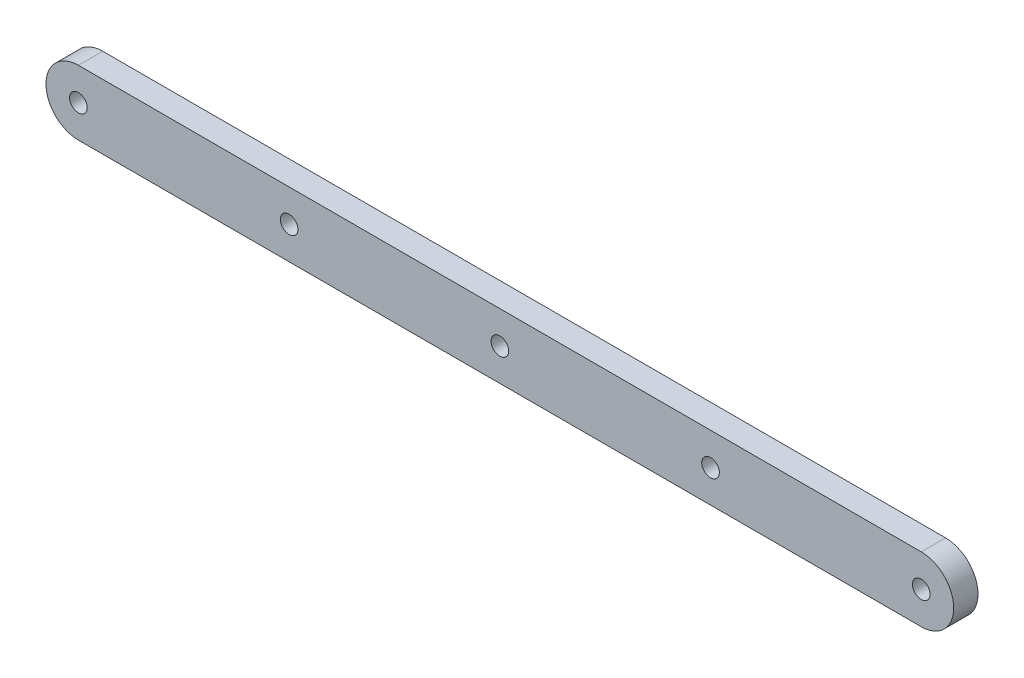
from build123d import *

# Parameters (mm, degrees)
BOSS_EXTRUDE1_DEPTH       = 4.7625
F_8_32_TAPPED_HOLE1_D     = 3.4544
F_8_32_TAPPED_HOLE1_DEPTH = 12.192
F_8_32_TAPPED_HOLE1_TIP   = 1.037806461


with BuildPart() as part:
    # Sketch1 → Boss-Extrude1 (new body)
    with BuildSketch(Plane.XY):
        with BuildLine():
            Line((-82.55, 0), (82.55, 0))
            ThreePointArc((82.55, 0), (88.9, 6.35), (82.55, 12.7))
            Line((82.55, 12.7), (-82.55, 12.7))
            ThreePointArc((-82.55, 12.7), (-88.9, 6.35), (-82.55, 0))
        make_face()
    extrude(amount=BOSS_EXTRUDE1_DEPTH)

    # #8-32 Tapped Hole1
    with Locations(Plane.XY.offset(4.7625)):
        with Locations((-82.55, 6.35), (82.55, 6.35), (0, 6.35), (41.27152138, 6.35), (-41.276070924, 6.35)):
            Hole(F_8_32_TAPPED_HOLE1_D / 2, depth=F_8_32_TAPPED_HOLE1_DEPTH)
            with Locations((0, 0, -(F_8_32_TAPPED_HOLE1_DEPTH + F_8_32_TAPPED_HOLE1_TIP / 2))):  # 118° drill point
                Cone(0, F_8_32_TAPPED_HOLE1_D / 2, F_8_32_TAPPED_HOLE1_TIP, mode=Mode.SUBTRACT)


solid = part.part
